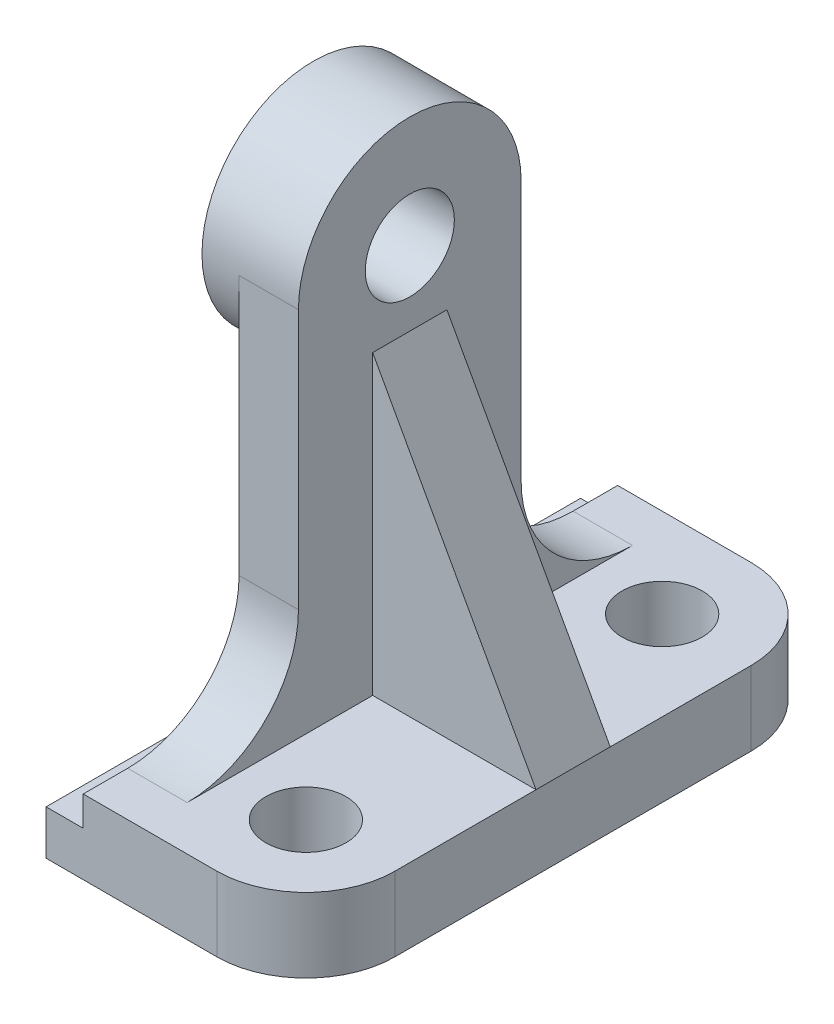
from build123d import *

# Parameters (mm, degrees)
BOSS_EXTRUDE1_DEPTH     = 36
FILLET1_R               = 12
BOSS_EXTRUDE2_DEPTH     = 8
FILLET2_R               = 15
BOSS_EXTRUDE3_START     = 5
SKETCH3_R               = 15
BOSS_EXTRUDE3_DEPTH     = 5
HOLE1_D                 = 12
M12X1_25_TAPPED_HOLE1_D = 10.8
RIB1_REACH              = 92.255
SKETCH9_WALL_W          = 228.161236354
SKETCH9_WALL_H          = 10


with BuildPart() as part:
    # Sketch1 → Boss-Extrude1 (new, symmetric)
    with BuildSketch(Plane.XY):
        Polygon((0, 0), (0, 6), (5, 6), (5, 10), (35, 10), (35, 0), align=None)
    extrude(amount=BOSS_EXTRUDE1_DEPTH, both=True)

    # Fillet1
    fillet1_edges = [part.edges().sort_by_distance(p)[0] for p in [
        (35, 5, -36),
        (35, 5, 36),
    ]]
    fillet(fillet1_edges, radius=FILLET1_R)

    # Sketch2 → Boss-Extrude2 (add)
    with BuildSketch(Plane.ZY.offset(-5)):
        with BuildLine():
            Line((-15, 60), (-15, 10))
            Line((-15, 10), (15, 10))
            Line((15, 10), (15, 60))
            ThreePointArc((15, 60), (0, 75), (-15, 60))
        make_face()
    extrude(amount=-BOSS_EXTRUDE2_DEPTH)

    # Fillet2
    fillet2_edges = [part.edges().sort_by_distance(p)[0] for p in [
        (9, 10, 15),
        (9, 10, -15),
    ]]
    fillet(fillet2_edges, radius=FILLET2_R)

    # Sketch3 → Boss-Extrude3 (add)
    with BuildSketch(Plane.ZY.offset(-5).offset(BOSS_EXTRUDE3_START)):
        with Locations((0, 60)):
            Circle(SKETCH3_R)
    extrude(amount=-BOSS_EXTRUDE3_DEPTH)

    # Hole1 (through all)
    with Locations(Plane(origin=(13, 0, 0), x_dir=(0, 0, -1), z_dir=(1, 0, 0))):
        with Locations((0, 60)):
            Hole(HOLE1_D / 2)

    # M12x1.25 Tapped Hole1 (through all)
    with Locations(Plane(origin=(0, 10, 0), x_dir=(1, 0, 0), z_dir=(0, 1, 0))):
        with Locations((23, -24), (23, 24)):
            Hole(M12X1_25_TAPPED_HOLE1_D / 2)

    # Sketch9 wall → Rib1 (add, up to next)
    with BuildSketch(Plane(origin=(24, 30, 0), x_dir=(0.481918749772, -0.876215908677, 0), z_dir=(0.876215908677, 0.481918749772, 0)), mode=Mode.PRIVATE) as rib1_sk1:
        Rectangle(SKETCH9_WALL_W, SKETCH9_WALL_H)
    rib1_tool1 = extrude(rib1_sk1.sketch, amount=-RIB1_REACH, mode=Mode.PRIVATE) - part.part
    add(rib1_tool1.solids().sort_by_distance((24, 30, 0))[0])


solid = part.part
